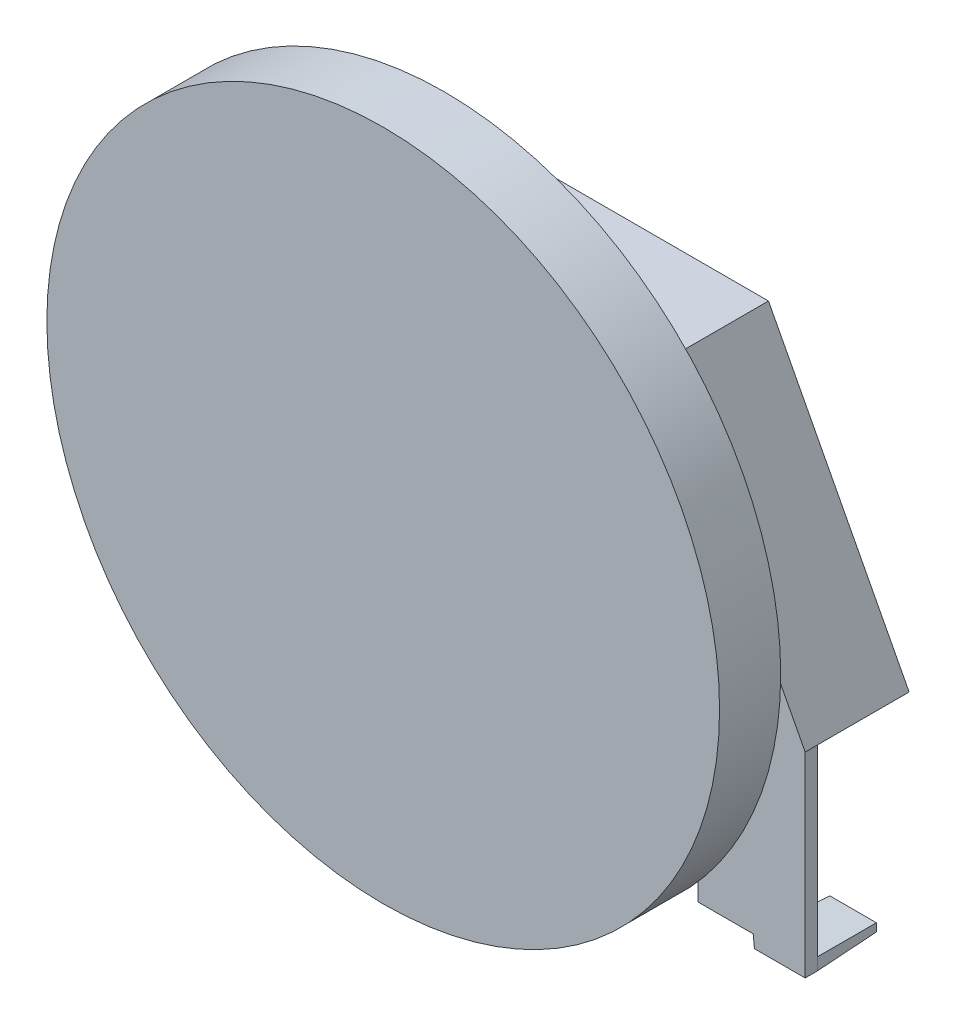
from build123d import *

# Parameters (mm, degrees)
SKETCH1_R                     = 11
BOSS_EXTRUDE1_DEPTH           = 2
SKETCH2_R                     = 7
BOSS_EXTRUDE2_DEPTH           = 2.2
SKETCH3_R                     = 5.5
BOSS_EXTRUDE3_DEPTH           = 1
BOSS_EXTRUDE4_DEPTH           = 0.4
BOSS_EXTRUDE5_DEPTH           = 3
SKETCH6_W                     = 1.66
SKETCH6_H                     = 0.4
BOSS_EXTRUDE6_DEPTH           = 2
BOSS_EXTRUDE6_DRAFT           = 2
SKETCH6_W_2                   = 1.289820998
BOSS_EXTRUDE6_PROFILE_2_DEPTH = 2
BOSS_EXTRUDE6_PROFILE_2_DRAFT = 2
BOSS_EXTRUDE6_PROFILE_3_DEPTH = 2
BOSS_EXTRUDE6_PROFILE_3_DRAFT = 2
BOSS_EXTRUDE6_PROFILE_4_DEPTH = 2
BOSS_EXTRUDE6_PROFILE_4_DRAFT = 2
BOSS_EXTRUDE6_PROFILE_5_DEPTH = 2
BOSS_EXTRUDE6_PROFILE_5_DRAFT = 2
SKETCH7_W                     = 17.2
SKETCH7_H                     = 6.6
CUT_EXTRUDE1_DEPTH            = 2


with BuildPart() as part:
    # Sketch1 → Boss-Extrude1 (new body)
    with BuildSketch(Plane.XY):
        Circle(SKETCH1_R)
    extrude(amount=BOSS_EXTRUDE1_DEPTH)

    # Sketch2 → Boss-Extrude2 (add)
    with BuildSketch(Plane(origin=(0, 0, 0), x_dir=(-1, 0, 0), z_dir=(0, 0, -1))):
        with Locations(Location((0, 0, 0), (0, 0, 180))):
            Circle(SKETCH2_R)
    extrude(amount=BOSS_EXTRUDE2_DEPTH)

    # Sketch3 → Boss-Extrude3 (add)
    with BuildSketch(Plane(origin=(0, 0, -2.2), x_dir=(-1, 0, 0), z_dir=(0, 0, -1))):
        Circle(SKETCH3_R)
    extrude(amount=BOSS_EXTRUDE3_DEPTH)

    # Sketch4 → Boss-Extrude4 (add)
    with BuildSketch(Plane(origin=(0, 0, -3.2), x_dir=(-1, 0, 0), z_dir=(0, 0, -1))):
        Polygon((-4, 3.774917218), (4, 3.774917218), (8.6, -5), (8.6, -18), (7.6, -18), (6.9, -11), (5.1, -11), (5.1, -2.059126028), (3.85, -2.059126028), (3.5, -18), (2.5, -18), (2.15, -2.059126028), (0.85, -2.059126028), (0.5, -18), (-0.5, -18), (-0.85, -2.059126028), (-2.15, -2.059126028), (-2.5, -18), (-3.5, -18), (-3.85, -2.059126028), (-5.1, -2.059126028), (-5.1, -11), (-6.9, -11), (-7.6, -18), (-8.6, -18), (-8.6, -5), align=None)
    extrude(amount=BOSS_EXTRUDE4_DEPTH)

    # Sketch5 → Boss-Extrude5 (add)
    with BuildSketch(Plane(origin=(0, 0, -3.6), x_dir=(-1, 0, 0), z_dir=(0, 0, -1))):
        Polygon((-8.6, -5), (-4, 3.774917218), (4, 3.774917218), (8.6, -5), align=None)
    extrude(amount=BOSS_EXTRUDE5_DEPTH)


with BuildPart() as boss_extrude6_tool:
    # Sketch6 → Boss-Extrude6 (with draft: the straight prism first)
    with BuildSketch(Plane(origin=(0, 0, -3.6), x_dir=(-1, 0, 0), z_dir=(0, 0, -1))):
        with Locations((7.77, -11.2)):
            Rectangle(SKETCH6_W, SKETCH6_H)
    extrude(amount=BOSS_EXTRUDE6_DEPTH)
    # Boss-Extrude6: the draft: its side faces are tilted about the plane it starts from
    boss_extrude6_sides = [boss_extrude6_tool.faces().sort_by_distance(p)[0] for p in [
        (-8.6, -11.2, -4.6),
        (-7.77, -11, -4.6),
        (-6.94, -11.2, -4.6),
        (-7.77, -11.4, -4.6),
    ]]
    draft(boss_extrude6_sides, Plane(origin=(0, 0, -3.6), x_dir=(-1, 0, 0), z_dir=(0, 0, -1)), BOSS_EXTRUDE6_DRAFT)


with BuildPart() as part_1:
    add(part.part)

    # Boss-Extrude6: add boss_extrude6_tool
    add(boss_extrude6_tool.part)


with BuildPart() as boss_extrude6_profile_2_tool:
    # Sketch6 → Boss-Extrude6 profile 2 (with draft: the straight prism first)
    with BuildSketch(Plane(origin=(0, 0, -3.6), x_dir=(-1, 0, 0), z_dir=(0, 0, -1))):
        with Locations((3, -11.2)):
            Rectangle(SKETCH6_W_2, SKETCH6_H)
    extrude(amount=BOSS_EXTRUDE6_PROFILE_2_DEPTH)
    # Boss-Extrude6 profile 2: the draft: its side faces are tilted about the plane it starts from
    boss_extrude6_profile_2_sides = [boss_extrude6_profile_2_tool.faces().sort_by_distance(p)[0] for p in [
        (-2.355089501, -11.2, -4.6),
        (-3, -11.4, -4.6),
        (-3.644910499, -11.2, -4.6),
        (-3, -11, -4.6),
    ]]
    draft(boss_extrude6_profile_2_sides, Plane(origin=(0, 0, -3.6), x_dir=(-1, 0, 0), z_dir=(0, 0, -1)), BOSS_EXTRUDE6_PROFILE_2_DRAFT)


with BuildPart() as part_2:
    add(part_1.part)

    # Boss-Extrude6 profile 2: add boss_extrude6_profile_2_tool
    add(boss_extrude6_profile_2_tool.part)


with BuildPart() as boss_extrude6_profile_3_tool:
    # Sketch6 → Boss-Extrude6 profile 3 (with draft: the straight prism first)
    with BuildSketch(Plane(origin=(0, 0, -3.6), x_dir=(-1, 0, 0), z_dir=(0, 0, -1))):
        with Locations((0, -11.2)):
            Rectangle(SKETCH6_W_2, SKETCH6_H)
    extrude(amount=BOSS_EXTRUDE6_PROFILE_3_DEPTH)
    # Boss-Extrude6 profile 3: the draft: its side faces are tilted about the plane it starts from
    boss_extrude6_profile_3_sides = [boss_extrude6_profile_3_tool.faces().sort_by_distance(p)[0] for p in [
        (0.644910499, -11.2, -4.6),
        (0, -11.4, -4.6),
        (-0.644910499, -11.2, -4.6),
        (0, -11, -4.6),
    ]]
    draft(boss_extrude6_profile_3_sides, Plane(origin=(0, 0, -3.6), x_dir=(-1, 0, 0), z_dir=(0, 0, -1)), BOSS_EXTRUDE6_PROFILE_3_DRAFT)


with BuildPart() as part_3:
    add(part_2.part)

    # Boss-Extrude6 profile 3: add boss_extrude6_profile_3_tool
    add(boss_extrude6_profile_3_tool.part)


with BuildPart() as boss_extrude6_profile_4_tool:
    # Sketch6 → Boss-Extrude6 profile 4 (with draft: the straight prism first)
    with BuildSketch(Plane(origin=(0, 0, -3.6), x_dir=(-1, 0, 0), z_dir=(0, 0, -1))):
        with Locations((-3, -11.2)):
            Rectangle(SKETCH6_W_2, SKETCH6_H)
    extrude(amount=BOSS_EXTRUDE6_PROFILE_4_DEPTH)
    # Boss-Extrude6 profile 4: the draft: its side faces are tilted about the plane it starts from
    boss_extrude6_profile_4_sides = [boss_extrude6_profile_4_tool.faces().sort_by_distance(p)[0] for p in [
        (3.644910499, -11.2, -4.6),
        (3, -11.4, -4.6),
        (2.355089501, -11.2, -4.6),
        (3, -11, -4.6),
    ]]
    draft(boss_extrude6_profile_4_sides, Plane(origin=(0, 0, -3.6), x_dir=(-1, 0, 0), z_dir=(0, 0, -1)), BOSS_EXTRUDE6_PROFILE_4_DRAFT)


with BuildPart() as part_4:
    add(part_3.part)

    # Boss-Extrude6 profile 4: add boss_extrude6_profile_4_tool
    add(boss_extrude6_profile_4_tool.part)


with BuildPart() as boss_extrude6_profile_5_tool:
    # Sketch6 → Boss-Extrude6 profile 5 (with draft: the straight prism first)
    with BuildSketch(Plane(origin=(0, 0, -3.6), x_dir=(-1, 0, 0), z_dir=(0, 0, -1))):
        with Locations((-7.77, -11.2)):
            Rectangle(SKETCH6_W, SKETCH6_H)
    extrude(amount=BOSS_EXTRUDE6_PROFILE_5_DEPTH)
    # Boss-Extrude6 profile 5: the draft: its side faces are tilted about the plane it starts from
    boss_extrude6_profile_5_sides = [boss_extrude6_profile_5_tool.faces().sort_by_distance(p)[0] for p in [
        (6.94, -11.2, -4.6),
        (7.77, -11, -4.6),
        (8.6, -11.2, -4.6),
        (7.77, -11.4, -4.6),
    ]]
    draft(boss_extrude6_profile_5_sides, Plane(origin=(0, 0, -3.6), x_dir=(-1, 0, 0), z_dir=(0, 0, -1)), BOSS_EXTRUDE6_PROFILE_5_DRAFT)


with BuildPart() as part_5:
    add(part_4.part)

    # Boss-Extrude6 profile 5: add boss_extrude6_profile_5_tool
    add(boss_extrude6_profile_5_tool.part)

    # Sketch7 → Cut-Extrude1 (cut)
    with BuildSketch(Plane(origin=(0, 0, -3.6), x_dir=(-1, 0, 0), z_dir=(0, 0, -1))):
        with Locations((0, -14.7)):
            Rectangle(SKETCH7_W, SKETCH7_H)
    extrude(amount=-CUT_EXTRUDE1_DEPTH, mode=Mode.SUBTRACT)


solid = part_5.part
